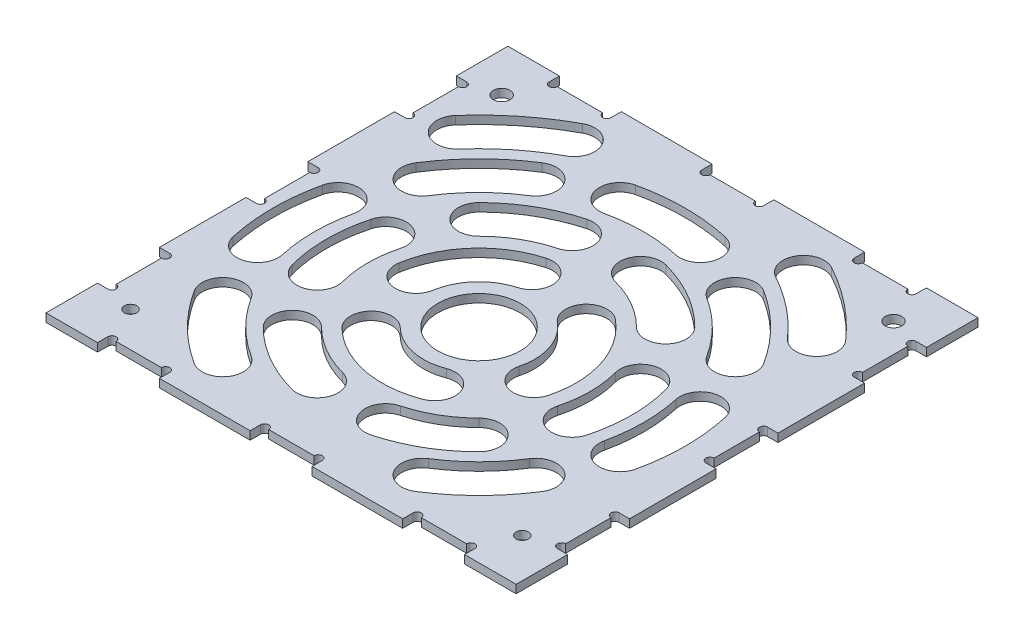
from build123d import *

# Parameters (mm, degrees)
SKETCH_1_W          = 109
SKETCH_1_H          = 107
SKETCH_1_R          = 2
SKETCH_1_R_2        = 1.5
EXTRUDE_1_DEPTH     = 2
SKETCH_2_W          = 22
SKETCH_2_H          = 2.5
SKETCH_2_W_2        = 2.5
SKETCH_2_H_2        = 21
EXTRUDE_2_DEPTH     = 2
CUT_EXTRUDE_1_DEPTH = 157.289794932
SKETCH_5_R          = 10
CUT_EXTRUDE_2_DEPTH = 157.289794932


with BuildPart() as part:
    # 草图1 → 凸台-拉伸1 (new body)
    with BuildSketch(Plane(origin=(0, 0, 0), x_dir=(1, 0, 0), z_dir=(0, 1, 0))):
        with Locations((54.5, 53.5)):
            Rectangle(SKETCH_1_W, SKETCH_1_H)
        with Locations(Location((7, 98.5, 0), (0, 0, 270))):
            Circle(SKETCH_1_R, mode=Mode.SUBTRACT)
        with Locations(Location((102, 98.5, 0), (0, 0, 270))):
            Circle(SKETCH_1_R, mode=Mode.SUBTRACT)
        with Locations(Location((102, 8.5, 0), (0, 0, 270))):
            Circle(SKETCH_1_R_2, mode=Mode.SUBTRACT)
        with Locations(Location((7, 8.5, 0), (0, 0, 270))):
            Circle(SKETCH_1_R_2, mode=Mode.SUBTRACT)
        with BuildLine():
            ThreePointArc((46.648648649, 69.625435598), (35.486686915, 62.669520248), (29.810194464, 50.805643076))
            ThreePointArc((29.810194464, 50.805643076), (33.934484349, 45.061930605), (39.67819682, 49.18622049))
            ThreePointArc((39.67819682, 49.18622049), (42.939160568, 56.001639291), (49.351351351, 59.997590663))
            ThreePointArc((49.351351351, 59.997590663), (52.813922468, 66.162864482), (46.648648649, 69.625435598))
        make_face(mode=Mode.SUBTRACT)
        with BuildLine():
            ThreePointArc((66.080568026, 43.661027088), (65.826068018, 51.212122886), (61.554224073, 57.443909733))
            ThreePointArc((61.554224073, 57.443909733), (60.854340495, 64.480255587), (67.890686349, 65.180139165))
            ThreePointArc((67.890686349, 65.180139165), (75.326859142, 54.332213912), (75.769877675, 41.187713819))
            ThreePointArc((75.769877675, 41.187713819), (69.688566217, 37.579715629), (66.080568026, 43.661027088))
        make_face(mode=Mode.SUBTRACT)
        with BuildLine():
            ThreePointArc((43.568080622, 37.341382249), (50.234771414, 33.786237823), (57.767579107, 34.369869777))
            ThreePointArc((57.767579107, 34.369869777), (64.211175155, 31.457813808), (61.299119186, 25.014217759))
            ThreePointArc((61.299119186, 25.014217759), (48.186453943, 23.99826584), (36.581473676, 30.186850582))
            ThreePointArc((36.581473676, 30.186850582), (36.497511316, 37.257419889), (43.568080622, 37.341382249))
        make_face(mode=Mode.SUBTRACT)
    extrude(amount=EXTRUDE_1_DEPTH)

    # 草图2 → 凸台-拉伸2 (add)
    with BuildSketch(Plane(origin=(0, 2, 0), x_dir=(1, 0, 0), z_dir=(0, 1, 0))):
        Polygon((10, 107), (10, 109.5), (-2.5, 109.5), (-2.5, 97), (0, 97), (0, 107), align=None)
        with Locations((36, 108.25)):
            Rectangle(SKETCH_2_W, SKETCH_2_H)
        with Locations((73, 108.25)):
            Rectangle(SKETCH_2_W, SKETCH_2_H)
        Polygon((99, 107), (99, 109.5), (111.5, 109.5), (111.5, 97), (109, 97), (109, 107), align=None)
        with Locations((110.25, 35.5)):
            Rectangle(SKETCH_2_W_2, SKETCH_2_H_2)
        with Locations((-1.25, 71.5)):
            Rectangle(SKETCH_2_W_2, SKETCH_2_H_2)
        with Locations((-1.25, 35.5)):
            Rectangle(SKETCH_2_W_2, SKETCH_2_H_2)
        with Locations((110.25, 71.5)):
            Rectangle(SKETCH_2_W_2, SKETCH_2_H_2)
        Polygon((111.5, -2.5), (111.5, 10), (109, 10), (109, 0), (99, 0), (99, -2.5), align=None)
        with Locations((73, -1.25)):
            Rectangle(SKETCH_2_W, SKETCH_2_H)
        with Locations((36, -1.25)):
            Rectangle(SKETCH_2_W, SKETCH_2_H)
        Polygon((-2.5, -2.5), (-2.5, 10), (0, 10), (0, 0), (10, 0), (10, -2.5), align=None)
    extrude(amount=-EXTRUDE_2_DEPTH)

    # 草图4 → 切除-拉伸1 (cut, through all)
    with BuildSketch(Plane(origin=(0, 2, 0), x_dir=(1, 0, 0), z_dir=(0, 1, 0))):
        with BuildLine():
            Line((10, 107), (12, 107))
            ThreePointArc((12, 107), (11, 106), (10, 107))
        make_face()
        with BuildLine():
            Line((25, 107), (23, 107))
            ThreePointArc((23, 107), (24, 106), (25, 107))
        make_face()
        with BuildLine():
            Line((47, 107), (49, 107))
            ThreePointArc((49, 107), (48, 106), (47, 107))
        make_face()
        with BuildLine():
            Line((62, 107), (60, 107))
            ThreePointArc((60, 107), (61, 106), (62, 107))
        make_face()
        with BuildLine():
            Line((84, 107), (86, 107))
            ThreePointArc((86, 107), (85, 106), (84, 107))
        make_face()
        with BuildLine():
            Line((99, 107), (97, 107))
            ThreePointArc((97, 107), (98, 106), (99, 107))
        make_face()
        with BuildLine():
            Line((0, 84), (0, 82))
            ThreePointArc((0, 82), (1, 83), (0, 84))
        make_face()
        with BuildLine():
            Line((99, 0), (97, 0))
            ThreePointArc((97, 0), (98, 1), (99, 0))
        make_face()
        with BuildLine():
            Line((84, 0), (86, 0))
            ThreePointArc((86, 0), (85, 1), (84, 0))
        make_face()
        with BuildLine():
            Line((62, 0), (60, 0))
            ThreePointArc((60, 0), (61, 1), (62, 0))
        make_face()
        with BuildLine():
            Line((47, 0), (49, 0))
            ThreePointArc((49, 0), (48, 1), (47, 0))
        make_face()
        with BuildLine():
            Line((25, 0), (23, 0))
            ThreePointArc((23, 0), (24, 1), (25, 0))
        make_face()
        with BuildLine():
            Line((10, 0), (12, 0))
            ThreePointArc((12, 0), (11, 1), (10, 0))
        make_face()
        with BuildLine():
            Line((0, 95), (0, 97))
            ThreePointArc((0, 97), (1, 96), (0, 95))
        make_face()
        with BuildLine():
            Line((0, 59), (0, 61))
            ThreePointArc((0, 61), (1, 60), (0, 59))
        make_face()
        with BuildLine():
            Line((0, 48), (0, 46))
            ThreePointArc((0, 46), (1, 47), (0, 48))
        make_face()
        with BuildLine():
            Line((0, 12), (0, 10))
            ThreePointArc((0, 10), (1, 11), (0, 12))
        make_face()
        with BuildLine():
            Line((0, 23), (0, 25))
            ThreePointArc((0, 25), (1, 24), (0, 23))
        make_face()
        with BuildLine():
            Line((109, 23), (109, 25))
            ThreePointArc((109, 25), (108, 24), (109, 23))
        make_face()
        with BuildLine():
            Line((109, 12), (109, 10))
            ThreePointArc((109, 10), (108, 11), (109, 12))
        make_face()
        with BuildLine():
            Line((109, 48), (109, 46))
            ThreePointArc((109, 46), (108, 47), (109, 48))
        make_face()
        with BuildLine():
            Line((109, 59), (109, 61))
            ThreePointArc((109, 61), (108, 60), (109, 59))
        make_face()
        with BuildLine():
            Line((109, 95), (109, 97))
            ThreePointArc((109, 97), (108, 96), (109, 95))
        make_face()
        with BuildLine():
            Line((109, 84), (109, 82))
            ThreePointArc((109, 82), (108, 83), (109, 84))
        make_face()
    extrude(amount=-CUT_EXTRUDE_1_DEPTH, mode=Mode.SUBTRACT)

    # 草图5 → 切除-拉伸2 (cut, through all)
    with BuildSketch(Plane(origin=(0, 2, 0), x_dir=(1, 0, 0), z_dir=(0, 1, 0))):
        with Locations(Location((53, 47, 0), (0, 0, 270))):
            Circle(SKETCH_5_R)
        with BuildLine():
            ThreePointArc((43.423695331, 82.739255573), (34.5, 79.04293994), (26.837049096, 73.162950904))
            ThreePointArc((26.837049096, 73.162950904), (26.837049096, 66.091883092), (33.908116908, 66.091883092))
            ThreePointArc((33.908116908, 66.091883092), (39.5, 70.382685902), (46.011885782, 73.07999731))
            ThreePointArc((46.011885782, 73.07999731), (49.547419688, 79.203721667), (43.423695331, 82.739255573))
        make_face()
        with BuildLine():
            ThreePointArc((79.162950904, 73.162950904), (71.5, 79.04293994), (62.576304669, 82.739255573))
            ThreePointArc((62.576304669, 82.739255573), (56.452580312, 79.203721667), (59.988114218, 73.07999731))
            ThreePointArc((59.988114218, 73.07999731), (66.5, 70.382685902), (72.091883092, 66.091883092))
            ThreePointArc((72.091883092, 66.091883092), (79.162950904, 66.091883092), (79.162950904, 73.162950904))
        make_face()
        with BuildLine():
            ThreePointArc((88.739255573, 37.423695331), (90, 47), (88.739255573, 56.576304669))
            ThreePointArc((88.739255573, 56.576304669), (82.615531216, 60.111838575), (79.07999731, 53.988114218))
            ThreePointArc((79.07999731, 53.988114218), (80, 47), (79.07999731, 40.011885782))
            ThreePointArc((79.07999731, 40.011885782), (82.615531216, 33.888161425), (88.739255573, 37.423695331))
        make_face()
        with BuildLine():
            ThreePointArc((62.576304669, 11.260744427), (71.5, 14.95706006), (79.162950904, 20.837049096))
            ThreePointArc((79.162950904, 20.837049096), (79.162950904, 27.908116908), (72.091883092, 27.908116908))
            ThreePointArc((72.091883092, 27.908116908), (66.5, 23.617314098), (59.988114218, 20.92000269))
            ThreePointArc((59.988114218, 20.92000269), (56.452580312, 14.796278333), (62.576304669, 11.260744427))
        make_face()
        with BuildLine():
            ThreePointArc((26.837049096, 20.837049096), (34.5, 14.95706006), (43.423695331, 11.260744427))
            ThreePointArc((43.423695331, 11.260744427), (49.547419688, 14.796278333), (46.011885782, 20.92000269))
            ThreePointArc((46.011885782, 20.92000269), (39.5, 23.617314098), (33.908116908, 27.908116908))
            ThreePointArc((33.908116908, 27.908116908), (26.837049096, 27.908116908), (26.837049096, 20.837049096))
        make_face()
        with BuildLine():
            ThreePointArc((17.260744427, 56.576304669), (16, 47), (17.260744427, 37.423695331))
            ThreePointArc((17.260744427, 37.423695331), (23.384468784, 33.888161425), (26.92000269, 40.011885782))
            ThreePointArc((26.92000269, 40.011885782), (26, 47), (26.92000269, 53.988114218))
            ThreePointArc((26.92000269, 53.988114218), (23.384468784, 60.111838575), (17.260744427, 56.576304669))
        make_face()
        with BuildLine():
            ThreePointArc((26.135019411, 89.169572181), (17.644660797, 82.355338916), (10.8304276, 73.864980246))
            ThreePointArc((10.8304276, 73.864980246), (12.360886816, 66.961524981), (19.26434208, 68.491984197))
            ThreePointArc((19.26434208, 68.491984197), (24.715728638, 75.284271132), (31.508015529, 80.735657745))
            ThreePointArc((31.508015529, 80.735657745), (33.038474688, 87.639113022), (26.135019411, 89.169572181))
        make_face()
        with BuildLine():
            ThreePointArc((61.657584558, 86.05183944), (53, 86.999999155), (44.342415442, 86.05183944))
            ThreePointArc((44.342415442, 86.05183944), (38.378737337, 89.851121406), (42.178019303, 95.814799511))
            ThreePointArc((42.178019303, 95.814799511), (53, 96.999999155), (63.821980697, 95.814799511))
            ThreePointArc((63.821980697, 95.814799511), (67.621262663, 89.851121406), (61.657584558, 86.05183944))
        make_face()
        with BuildLine():
            ThreePointArc((86.73565792, 68.491984197), (81.284271362, 75.284271132), (74.491984471, 80.735657745))
            ThreePointArc((74.491984471, 80.735657745), (72.961525312, 87.639113022), (79.864980589, 89.169572181))
            ThreePointArc((79.864980589, 89.169572181), (88.355339203, 82.355338916), (95.1695724, 73.864980246))
            ThreePointArc((95.1695724, 73.864980246), (93.639113184, 66.961524981), (86.73565792, 68.491984197))
        make_face()
        with BuildLine():
            ThreePointArc((92.05184025, 38.342415284), (93, 46.999999837), (92.05184032, 55.657584399))
            ThreePointArc((92.05184032, 55.657584399), (95.85112231, 61.621262489), (101.8148004, 57.821980498))
            ThreePointArc((101.8148004, 57.821980498), (103, 46.999999797), (101.814800312, 36.178019105))
            ThreePointArc((101.814800312, 36.178019105), (95.851122191, 32.378737163), (92.05184025, 38.342415284))
        make_face()
        with BuildLine():
            ThreePointArc((74.491984197, 13.26434208), (81.284271132, 18.715728638), (86.735657745, 25.508015529))
            ThreePointArc((86.735657745, 25.508015529), (93.639113022, 27.038474688), (95.169572181, 20.135019411))
            ThreePointArc((95.169572181, 20.135019411), (88.355338916, 11.644660797), (79.864980246, 4.8304276))
            ThreePointArc((79.864980246, 4.8304276), (72.961524981, 6.360886816), (74.491984197, 13.26434208))
        make_face()
        with BuildLine():
            ThreePointArc((19.264341914, 25.508015218), (24.715728419, 18.71572824), (31.508015269, 13.264341575))
            ThreePointArc((31.508015269, 13.264341575), (33.038474375, 6.360886287), (26.135019086, 4.830427181))
            ThreePointArc((26.135019086, 4.830427181), (17.644660524, 11.644660512), (10.830427393, 20.135019234))
            ThreePointArc((10.830427393, 20.135019234), (12.360886662, 27.038474487), (19.264341914, 25.508015218))
        make_face()
        with BuildLine():
            ThreePointArc((13.94815968, 55.657584399), (13, 46.999999837), (13.94815975, 38.342415284))
            ThreePointArc((13.94815975, 38.342415284), (10.148877809, 32.378737163), (4.185199688, 36.178019105))
            ThreePointArc((4.185199688, 36.178019105), (3, 46.999999797), (4.1851996, 57.821980498))
            ThreePointArc((4.1851996, 57.821980498), (10.14887769, 61.621262489), (13.94815968, 55.657584399))
        make_face()
        with BuildLine():
            ThreePointArc((22.783341301, 102.2806796), (13.64301097, 96.193774144), (5.698522836, 88.612140753))
            ThreePointArc((5.698522836, 88.612140753), (6.150057471, 81.55550441), (13.206693814, 82.007039046))
            ThreePointArc((13.206693814, 82.007039046), (19.890152086, 88.385238565), (27.579636332, 93.505968552))
            ThreePointArc((27.579636332, 93.505968552), (29.56884434, 100.291471592), (22.783341301, 102.2806796))
        make_face()
        with BuildLine():
            ThreePointArc((92.793306186, 82.007039046), (86.109847914, 88.385238565), (78.420363668, 93.505968552))
            ThreePointArc((78.420363668, 93.505968552), (76.43115566, 100.291471592), (83.216658699, 102.2806796))
            ThreePointArc((83.216658699, 102.2806796), (92.35698903, 96.193774144), (100.301477164, 88.612140753))
            ThreePointArc((100.301477164, 88.612140753), (99.849942529, 81.55550441), (92.793306186, 82.007039046))
        make_face()
    extrude(amount=-CUT_EXTRUDE_2_DEPTH, mode=Mode.SUBTRACT)


solid = part.part
